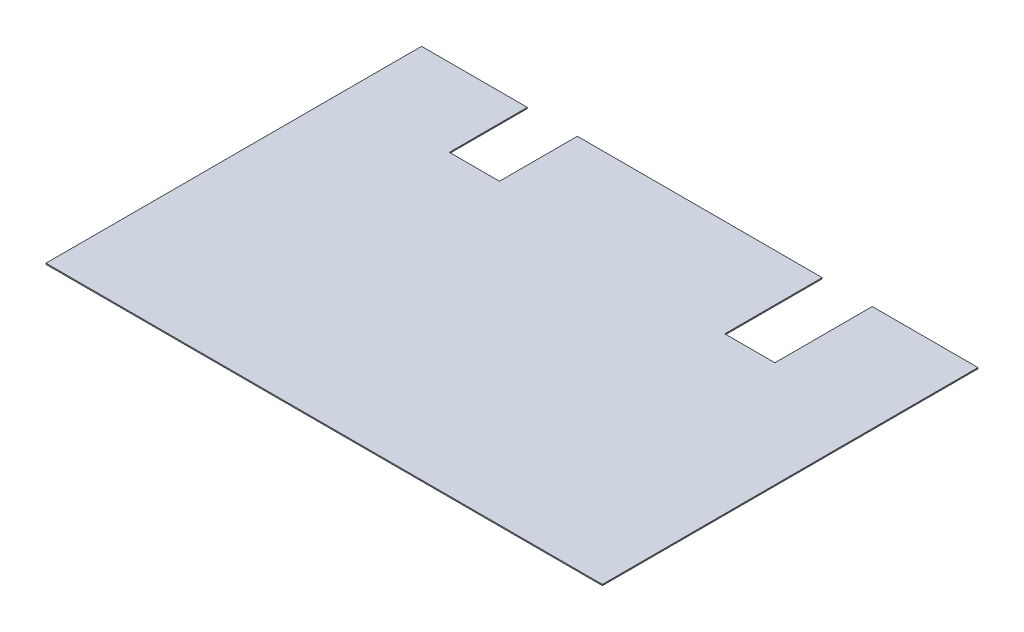
from build123d import *

# Parameters (mm, degrees)
SKETCH1_W           = 25.4
SKETCH1_H           = 17.145
BOSS_EXTRUDE1_DEPTH = 0.0508
CUT_EXTRUDE1_DEPTH  = 31.644960526


with BuildPart() as part:
    # Sketch1 → Boss-Extrude1 (new body)
    with BuildSketch(Plane(origin=(0, 0, 0), x_dir=(1, 0, 0), z_dir=(0, 1, 0))):
        with Locations((12.7, 8.5725)):
            Rectangle(SKETCH1_W, SKETCH1_H)
    extrude(amount=BOSS_EXTRUDE1_DEPTH)

    # Sketch2 → Cut-Extrude1 (cut, through all)
    with BuildSketch(Plane(origin=(0, 0.0508, 0), x_dir=(1, 0, 0), z_dir=(0, 1, 0))):
        Polygon((6.0325, 17.145), (7.112, 17.145), (7.112, 13.589), (4.826, 13.589), (4.826, 14.605), (4.826, 17.145), align=None)
        Polygon((18.288, 17.145), (19.3675, 17.145), (20.574, 17.145), (20.574, 13.589), (20.574, 12.7), (18.288, 12.7), align=None)
    extrude(amount=-CUT_EXTRUDE1_DEPTH, mode=Mode.SUBTRACT)


solid = part.part
